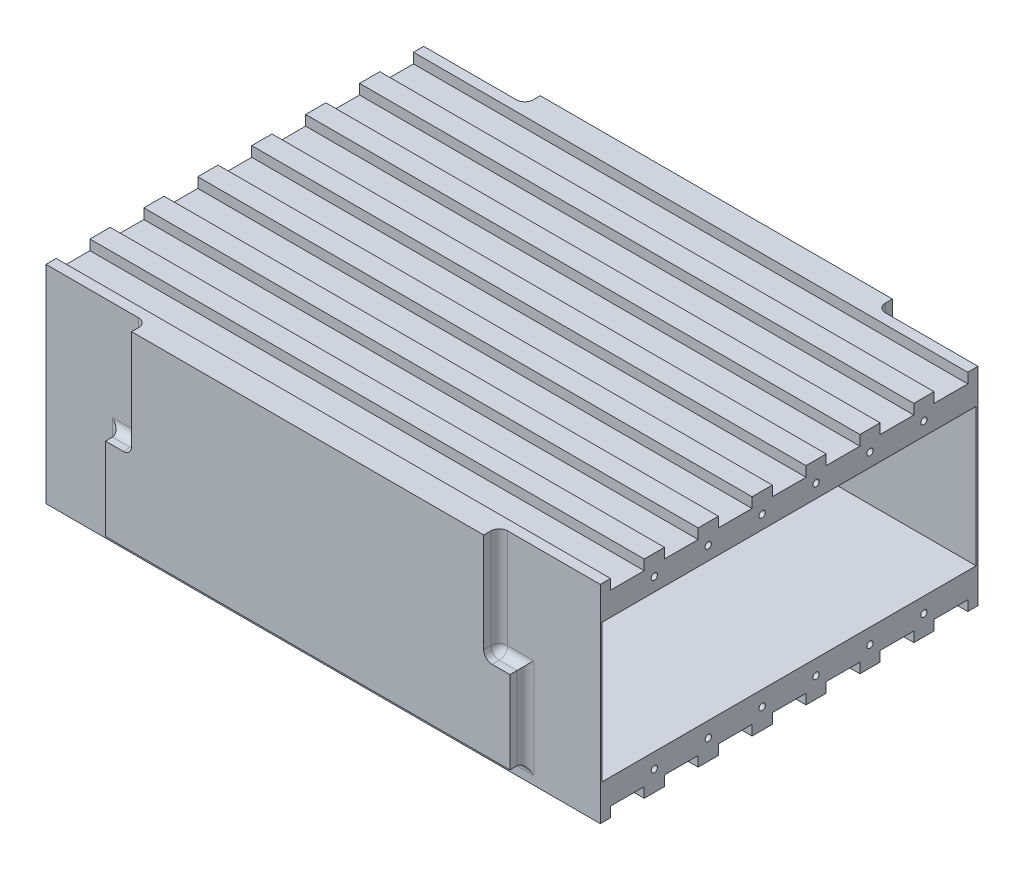
from build123d import *

# Parameters (mm, degrees)
SKETCH1_W                             = 104.4448
SKETCH1_H                             = 77.0128
BOSS_EXTRUDE1_DEPTH                   = 32.7025
SKETCH2_W                             = 104.4448
SKETCH2_H                             = 70.485
CUT_EXTRUDE1_DEPTH                    = 26.035
SKETCH3_W                             = 104.4448
SKETCH3_H                             = 77.0128
BOSS_EXTRUDE2_DEPTH                   = 6.35
SKETCH4_W                             = 19.05
SKETCH4_H                             = 2.921
CUT_EXTRUDE2_DEPTH                    = 20.32
SKETCH6_W                             = 14.1224
SKETCH6_H                             = 2.921
CUT_EXTRUDE3_DEPTH                    = 22.225
MIRROR2_COPY_1_SKETCH_W               = 19.05
MIRROR2_COPY_1_SKETCH_H               = 2.921
MIRROR2_COPY_1_DEPTH                  = 20.32
MIRROR2_COPY_2_SKETCH_W               = 14.1224
MIRROR2_COPY_2_SKETCH_H               = 2.921
MIRROR2_COPY_2_DEPTH                  = 22.225
SKETCH15_W                            = 2.921
SKETCH15_H                            = 3.175
CUT_EXTRUDE5_DEPTH                    = 106.669184434
FILLET2_R                             = 1.5875
FILLET2_OF_MIRROR6_R                  = 1.5875
F_56_0_0465_DIAMETER_HOLE1_AT_2_COUNT = 2
F_56_0_0465_DIAMETER_HOLE1_AT_2_PITCH = 10.16
F_56_0_0465_DIAMETER_HOLE1_AT_3_COUNT = 2
F_56_0_0465_DIAMETER_HOLE1_AT_3_PITCH = 20.32
F_56_0_0465_DIAMETER_HOLE1_AT_4_COUNT = 2
F_56_0_0465_DIAMETER_HOLE1_AT_4_PITCH = 37.428658221
F_56_0_0465_DIAMETER_HOLE1_AT_5_COUNT = 2
F_56_0_0465_DIAMETER_HOLE1_AT_5_PITCH = 33.033735124
F_56_0_0465_DIAMETER_HOLE1_AT_6_COUNT = 2
F_56_0_0465_DIAMETER_HOLE1_AT_6_PITCH = 31.4325
FILLET1_R                             = 1.5875
SKETCH13_W                            = 6.35
SKETCH13_H                            = 1.905
CUT_EXTRUDE4_DEPTH                    = 118.968456989
LPATTERN1_COUNT                       = 4
LPATTERN1_PITCH                       = 10.16
LPATTERN1_COL_COUNT                   = 4
LPATTERN1_COL_PITCH                   = 10.16


with BuildPart() as part:
    # Sketch1 → Boss-Extrude1 (new body)
    with BuildSketch(Plane(origin=(0, 0, 0), x_dir=(1, 0, 0), z_dir=(0, 1, 0))):
        Rectangle(SKETCH1_W, SKETCH1_H)
    extrude(amount=BOSS_EXTRUDE1_DEPTH)

    # Sketch2 → Cut-Extrude1 (cut)
    with BuildSketch(Plane(origin=(0, 32.7025, 0), x_dir=(1, 0, 0), z_dir=(0, 1, 0))):
        Rectangle(SKETCH2_W, SKETCH2_H)
    extrude(amount=-CUT_EXTRUDE1_DEPTH, mode=Mode.SUBTRACT)

    # Sketch3 → Boss-Extrude2 (add)
    with BuildSketch(Plane(origin=(0, 32.7025, 0), x_dir=(1, 0, 0), z_dir=(0, 1, 0))):
        Rectangle(SKETCH3_W, SKETCH3_H)
    extrude(amount=BOSS_EXTRUDE2_DEPTH)

    # Sketch4 → Cut-Extrude2 (cut)
    with BuildSketch(Plane(origin=(0, 39.0525, 0), x_dir=(1, 0, 0), z_dir=(0, 1, 0))):
        with Locations((42.6974, -37.0459)):
            Rectangle(SKETCH4_W, SKETCH4_H)
    cut_extrude2 = extrude(amount=-CUT_EXTRUDE2_DEPTH, mode=Mode.SUBTRACT)

    # Sketch6 → Cut-Extrude3 (cut)
    with BuildSketch(Plane.XZ):
        with Locations((45.1612, 37.0459)):
            Rectangle(SKETCH6_W, SKETCH6_H)
    cut_extrude3 = extrude(amount=-CUT_EXTRUDE3_DEPTH, mode=Mode.SUBTRACT)

    # Mirror1: Cut-Extrude2, Cut-Extrude3 across plane
    add(cut_extrude2.mirror(Plane.XY), mode=Mode.SUBTRACT)
    add(cut_extrude3.mirror(Plane.XY), mode=Mode.SUBTRACT)

    # Mirror2: Cut-Extrude2, Cut-Extrude3 across plane
    add(cut_extrude2.mirror(Plane(origin=(0, 0, 0), x_dir=(0, 0, 1), z_dir=(1, 0, 0))), mode=Mode.SUBTRACT)
    add(cut_extrude3.mirror(Plane(origin=(0, 0, 0), x_dir=(0, 0, 1), z_dir=(1, 0, 0))), mode=Mode.SUBTRACT)

    # Mirror2 copy 1 sketch → Mirror2 copy 1 (cut)
    with BuildSketch(Plane(origin=(0, 39.0525, 0), x_dir=(-1, 0, 0), z_dir=(0, 1, 0))):
        with Locations((42.6974, -37.0459)):
            Rectangle(MIRROR2_COPY_1_SKETCH_W, MIRROR2_COPY_1_SKETCH_H)
    extrude(amount=-MIRROR2_COPY_1_DEPTH, mode=Mode.SUBTRACT)

    # Mirror2 copy 2 sketch → Mirror2 copy 2 (cut)
    with BuildSketch(Plane(origin=(0, 0, 0), x_dir=(-1, 0, 0), z_dir=(0, -1, 0))):
        with Locations((45.1612, 37.0459)):
            Rectangle(MIRROR2_COPY_2_SKETCH_W, MIRROR2_COPY_2_SKETCH_H)
    extrude(amount=-MIRROR2_COPY_2_DEPTH, mode=Mode.SUBTRACT)

    # Sketch15 → Cut-Extrude5 (cut, through all)
    with BuildSketch(Plane(origin=(38.1, 0, 0), x_dir=(0, 0, -1), z_dir=(1, 0, 0))):
        with Locations((-37.0459, 1.5875)):
            Rectangle(SKETCH15_W, SKETCH15_H)
    cut_extrude5 = extrude(amount=-CUT_EXTRUDE5_DEPTH, mode=Mode.SUBTRACT)

    # Fillet2
    fillet2_edges = [part.edges().sort_by_distance(p)[0] for p in [
        (0, 3.175, 35.5854),
    ]]
    fillet(fillet2_edges, radius=FILLET2_R)

    # Mirror6: Cut-Extrude5 across plane
    add(cut_extrude5.mirror(Plane.XY), mode=Mode.SUBTRACT)

    # Fillet2 of Mirror6
    fillet2_of_mirror6_edges = [part.edges().sort_by_distance(p)[0] for p in [
        (0, 3.175, -35.5854),
    ]]
    fillet(fillet2_of_mirror6_edges, radius=FILLET2_OF_MIRROR6_R)

    # Sketch11 → #56 (0.0465) Diameter Hole1 (revolve, cut)
    with BuildSketch(Plane(origin=(-52.2224, 35.2425, -5.08), x_dir=(0, 0, 1), z_dir=(0, 1, 0))):
        Polygon((0, 0), (0, 9.879838239), (0.59055, 9.525), (0.59055, 0), align=None)
    f_56_0_0465_diameter_hole1 = revolve(axis=Axis((-58.5724, 35.2425, -5.08), (1, 0, 0)), mode=Mode.SUBTRACT)

    # #56 (0.0465) Diameter Hole1 at 2: #56 (0.0465) Diameter Hole1 ×2
    with Locations(*[(0, 0, -i * F_56_0_0465_DIAMETER_HOLE1_AT_2_PITCH) for i in range(1, F_56_0_0465_DIAMETER_HOLE1_AT_2_COUNT)]):
        add(f_56_0_0465_diameter_hole1, mode=Mode.SUBTRACT)

    # #56 (0.0465) Diameter Hole1 at 3: #56 (0.0465) Diameter Hole1 ×2
    with Locations(*[(0, 0, -i * F_56_0_0465_DIAMETER_HOLE1_AT_3_PITCH) for i in range(1, F_56_0_0465_DIAMETER_HOLE1_AT_3_COUNT)]):
        add(f_56_0_0465_diameter_hole1, mode=Mode.SUBTRACT)

    # #56 (0.0465) Diameter Hole1 at 4: #56 (0.0465) Diameter Hole1 ×2
    with Locations(*[Vector(0, -0.8397976709215131, -0.5428995044341098) * (i * F_56_0_0465_DIAMETER_HOLE1_AT_4_PITCH) for i in range(1, F_56_0_0465_DIAMETER_HOLE1_AT_4_COUNT)]):
        add(f_56_0_0465_diameter_hole1, mode=Mode.SUBTRACT)

    # #56 (0.0465) Diameter Hole1 at 5: #56 (0.0465) Diameter Hole1 ×2
    with Locations(*[Vector(0, -0.9515272760377812, -0.3075643720526165) * (i * F_56_0_0465_DIAMETER_HOLE1_AT_5_PITCH) for i in range(1, F_56_0_0465_DIAMETER_HOLE1_AT_5_COUNT)]):
        add(f_56_0_0465_diameter_hole1, mode=Mode.SUBTRACT)

    # #56 (0.0465) Diameter Hole1 at 6: #56 (0.0465) Diameter Hole1 ×2
    with Locations(*[(0, -i * F_56_0_0465_DIAMETER_HOLE1_AT_6_PITCH, 0) for i in range(1, F_56_0_0465_DIAMETER_HOLE1_AT_6_COUNT)]):
        add(f_56_0_0465_diameter_hole1, mode=Mode.SUBTRACT)

    # Mirror4: #56 (0.0465) Diameter Hole1 across plane
    add(f_56_0_0465_diameter_hole1.mirror(Plane.XY), mode=Mode.SUBTRACT)

    # Mirror4 copy 1 sketch → Mirror4 copy 1 (revolve, cut)
    with BuildSketch(Plane(origin=(-52.2224, 35.2425, 15.24), x_dir=(0, 0, -1), z_dir=(0, 1, 0))):
        Polygon((0, 0), (0, -9.879838239), (0.59055, -9.525), (0.59055, 0), align=None)
    revolve(axis=Axis((-58.5724, 35.2425, 15.24), (-1, 0, 0)), mode=Mode.SUBTRACT)

    # Mirror4 copy 2 sketch → Mirror4 copy 2 (revolve, cut)
    with BuildSketch(Plane(origin=(-52.2224, 35.2425, 25.4), x_dir=(0, 0, -1), z_dir=(0, 1, 0))):
        Polygon((0, 0), (0, -9.879838239), (0.59055, -9.525), (0.59055, 0), align=None)
    revolve(axis=Axis((-58.5724, 35.2425, 25.4), (-1, 0, 0)), mode=Mode.SUBTRACT)

    # Mirror4 copy 3 sketch → Mirror4 copy 3 (revolve, cut)
    with BuildSketch(Plane(origin=(-52.2224, 3.81, 25.4), x_dir=(0, 0, -1), z_dir=(0, 1, 0))):
        Polygon((0, 0), (0, -9.879838239), (0.59055, -9.525), (0.59055, 0), align=None)
    revolve(axis=Axis((-58.5724, 3.81, 25.4), (-1, 0, 0)), mode=Mode.SUBTRACT)

    # Mirror4 copy 4 sketch → Mirror4 copy 4 (revolve, cut)
    with BuildSketch(Plane(origin=(-52.2224, 3.81, 15.24), x_dir=(0, 0, -1), z_dir=(0, 1, 0))):
        Polygon((0, 0), (0, -9.879838239), (0.59055, -9.525), (0.59055, 0), align=None)
    revolve(axis=Axis((-58.5724, 3.81, 15.24), (-1, 0, 0)), mode=Mode.SUBTRACT)

    # Mirror4 copy 5 sketch → Mirror4 copy 5 (revolve, cut)
    with BuildSketch(Plane(origin=(-52.2224, 3.81, 5.08), x_dir=(0, 0, -1), z_dir=(0, 1, 0))):
        Polygon((0, 0), (0, -9.879838239), (0.59055, -9.525), (0.59055, 0), align=None)
    revolve(axis=Axis((-58.5724, 3.81, 5.08), (-1, 0, 0)), mode=Mode.SUBTRACT)

    # Mirror5: #56 (0.0465) Diameter Hole1 across plane
    add(f_56_0_0465_diameter_hole1.mirror(Plane(origin=(0, 0, 0), x_dir=(0, 0, 1), z_dir=(1, 0, 0))), mode=Mode.SUBTRACT)

    # Mirror5 copy 1 sketch → Mirror5 copy 1 (revolve, cut)
    with BuildSketch(Plane(origin=(52.2224, 35.2425, -15.24), x_dir=(0, 0, 1), z_dir=(0, 1, 0))):
        Polygon((0, 0), (0, -9.879838239), (0.59055, -9.525), (0.59055, 0), align=None)
    revolve(axis=Axis((58.5724, 35.2425, -15.24), (1, 0, 0)), mode=Mode.SUBTRACT)

    # Mirror5 copy 2 sketch → Mirror5 copy 2 (revolve, cut)
    with BuildSketch(Plane(origin=(52.2224, 35.2425, -25.4), x_dir=(0, 0, 1), z_dir=(0, 1, 0))):
        Polygon((0, 0), (0, -9.879838239), (0.59055, -9.525), (0.59055, 0), align=None)
    revolve(axis=Axis((58.5724, 35.2425, -25.4), (1, 0, 0)), mode=Mode.SUBTRACT)

    # Mirror5 copy 3 sketch → Mirror5 copy 3 (revolve, cut)
    with BuildSketch(Plane(origin=(52.2224, 3.81, -25.4), x_dir=(0, 0, 1), z_dir=(0, 1, 0))):
        Polygon((0, 0), (0, -9.879838239), (0.59055, -9.525), (0.59055, 0), align=None)
    revolve(axis=Axis((58.5724, 3.81, -25.4), (1, 0, 0)), mode=Mode.SUBTRACT)

    # Mirror5 copy 4 sketch → Mirror5 copy 4 (revolve, cut)
    with BuildSketch(Plane(origin=(52.2224, 3.81, -15.24), x_dir=(0, 0, 1), z_dir=(0, 1, 0))):
        Polygon((0, 0), (0, -9.879838239), (0.59055, -9.525), (0.59055, 0), align=None)
    revolve(axis=Axis((58.5724, 3.81, -15.24), (1, 0, 0)), mode=Mode.SUBTRACT)

    # Mirror5 copy 5 sketch → Mirror5 copy 5 (revolve, cut)
    with BuildSketch(Plane(origin=(52.2224, 3.81, -5.08), x_dir=(0, 0, 1), z_dir=(0, 1, 0))):
        Polygon((0, 0), (0, -9.879838239), (0.59055, -9.525), (0.59055, 0), align=None)
    revolve(axis=Axis((58.5724, 3.81, -5.08), (1, 0, 0)), mode=Mode.SUBTRACT)

    # Mirror5 copy 6 sketch → Mirror5 copy 6 (revolve, cut)
    with BuildSketch(Plane(origin=(52.2224, 35.2425, 5.08), x_dir=(0, 0, -1), z_dir=(0, 1, 0))):
        Polygon((0, 0), (0, 9.879838239), (0.59055, 9.525), (0.59055, 0), align=None)
    revolve(axis=Axis((58.5724, 35.2425, 5.08), (-1, 0, 0)), mode=Mode.SUBTRACT)

    # Mirror5 copy 7 sketch → Mirror5 copy 7 (revolve, cut)
    with BuildSketch(Plane(origin=(52.2224, 35.2425, 15.24), x_dir=(0, 0, -1), z_dir=(0, 1, 0))):
        Polygon((0, 0), (0, 9.879838239), (0.59055, 9.525), (0.59055, 0), align=None)
    revolve(axis=Axis((58.5724, 35.2425, 15.24), (-1, 0, 0)), mode=Mode.SUBTRACT)

    # Mirror5 copy 8 sketch → Mirror5 copy 8 (revolve, cut)
    with BuildSketch(Plane(origin=(52.2224, 35.2425, 25.4), x_dir=(0, 0, -1), z_dir=(0, 1, 0))):
        Polygon((0, 0), (0, 9.879838239), (0.59055, 9.525), (0.59055, 0), align=None)
    revolve(axis=Axis((58.5724, 35.2425, 25.4), (-1, 0, 0)), mode=Mode.SUBTRACT)

    # Mirror5 copy 9 sketch → Mirror5 copy 9 (revolve, cut)
    with BuildSketch(Plane(origin=(52.2224, 3.81, 25.4), x_dir=(0, 0, -1), z_dir=(0, 1, 0))):
        Polygon((0, 0), (0, 9.879838239), (0.59055, 9.525), (0.59055, 0), align=None)
    revolve(axis=Axis((58.5724, 3.81, 25.4), (-1, 0, 0)), mode=Mode.SUBTRACT)

    # Mirror5 copy 10 sketch → Mirror5 copy 10 (revolve, cut)
    with BuildSketch(Plane(origin=(52.2224, 3.81, 15.24), x_dir=(0, 0, -1), z_dir=(0, 1, 0))):
        Polygon((0, 0), (0, 9.879838239), (0.59055, 9.525), (0.59055, 0), align=None)
    revolve(axis=Axis((58.5724, 3.81, 15.24), (-1, 0, 0)), mode=Mode.SUBTRACT)

    # Mirror5 copy 11 sketch → Mirror5 copy 11 (revolve, cut)
    with BuildSketch(Plane(origin=(52.2224, 3.81, 5.08), x_dir=(0, 0, -1), z_dir=(0, 1, 0))):
        Polygon((0, 0), (0, 9.879838239), (0.59055, 9.525), (0.59055, 0), align=None)
    revolve(axis=Axis((58.5724, 3.81, 5.08), (-1, 0, 0)), mode=Mode.SUBTRACT)

    # Fillet1
    fillet1_edges = [part.edges().sort_by_distance(p)[0] for p in [
        (-33.1724, 18.7325, -37.0459),
        (-33.1724, 28.8925, -35.5854),
        (-35.6362, 18.7325, -35.5854),
        (-38.1, 10.16, -35.5854),
        (-33.1724, 28.8925, 35.5854),
        (-33.1724, 18.7325, 37.0459),
        (-35.6362, 18.7325, 35.5854),
        (-38.1, 10.16, 35.5854),
        (33.1724, 18.7325, 37.0459),
        (33.1724, 28.8925, 35.5854),
        (35.6362, 18.7325, 35.5854),
        (38.1, 10.16, 35.5854),
        (33.1724, 28.8925, -35.5854),
        (33.1724, 18.7325, -37.0459),
        (35.6362, 18.7325, -35.5854),
        (38.1, 10.16, -35.5854),
    ]]
    fillet(fillet1_edges, radius=FILLET1_R)

    # Sketch13 → Cut-Extrude4 (cut, through all)
    with BuildSketch(Plane.ZY.offset(52.2224)):
        with Locations((0, 38.1)):
            Rectangle(SKETCH13_W, SKETCH13_H)
        with Locations((0, 0.9525)):
            Rectangle(SKETCH13_W, SKETCH13_H)
    cut_extrude4 = extrude(amount=-CUT_EXTRUDE4_DEPTH, mode=Mode.SUBTRACT)

    # LPattern1: Cut-Extrude4 ×4
    with Locations(*[(0, 0, i * LPATTERN1_PITCH) for i in range(1, LPATTERN1_COUNT)]):
        add(cut_extrude4, mode=Mode.SUBTRACT)

    # LPattern1 col: Cut-Extrude4 ×4
    with Locations(*[(0, 0, -i * LPATTERN1_COL_PITCH) for i in range(1, LPATTERN1_COL_COUNT)]):
        add(cut_extrude4, mode=Mode.SUBTRACT)


solid = part.part
